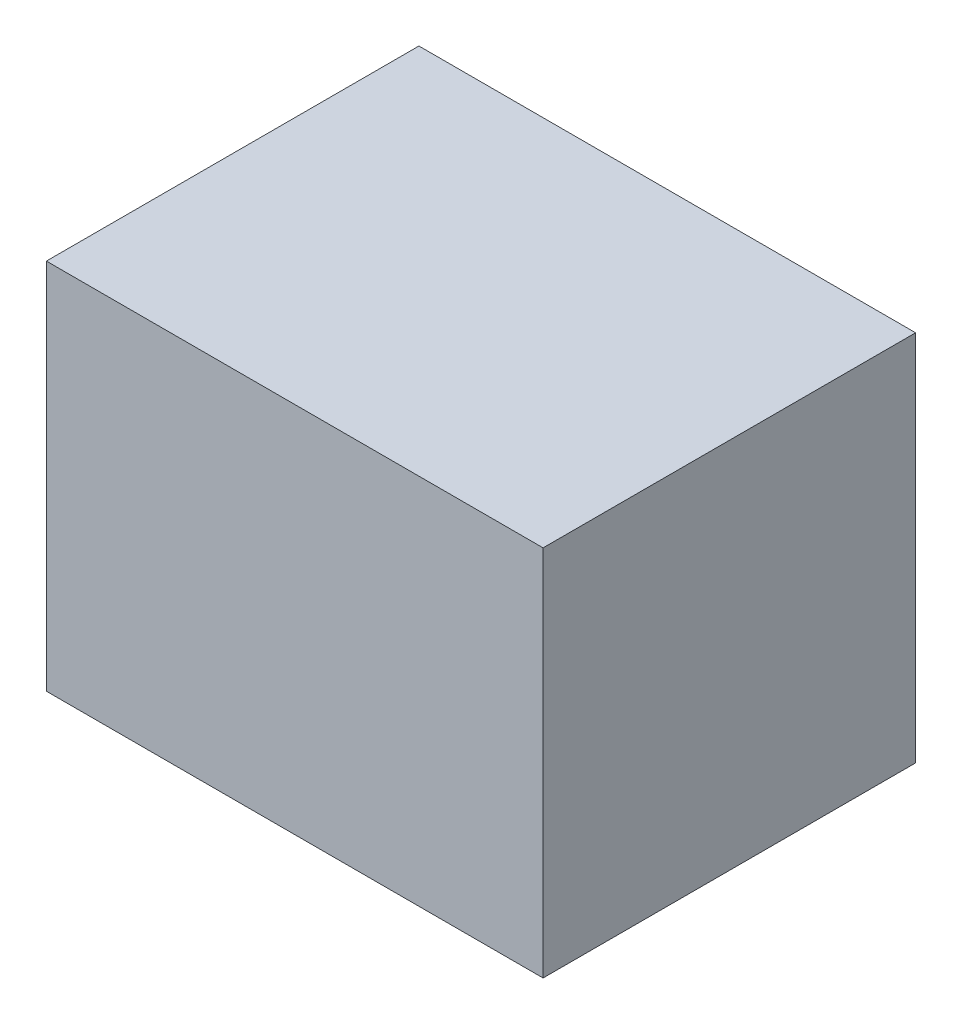
from build123d import *

# Parameters (mm, degrees)
SKETCH1_W           = 160
SKETCH1_H           = 120
BOSS_EXTRUDE1_DEPTH = 120


with BuildPart() as part:
    # Sketch1 → Boss-Extrude1 (new body)
    with BuildSketch(Plane(origin=(0, 0, 0), x_dir=(1, 0, 0), z_dir=(0, 1, 0))):
        with Locations((-15.631123919, 14.564841499)):
            Rectangle(SKETCH1_W, SKETCH1_H)
    extrude(amount=BOSS_EXTRUDE1_DEPTH)


solid = part.part
